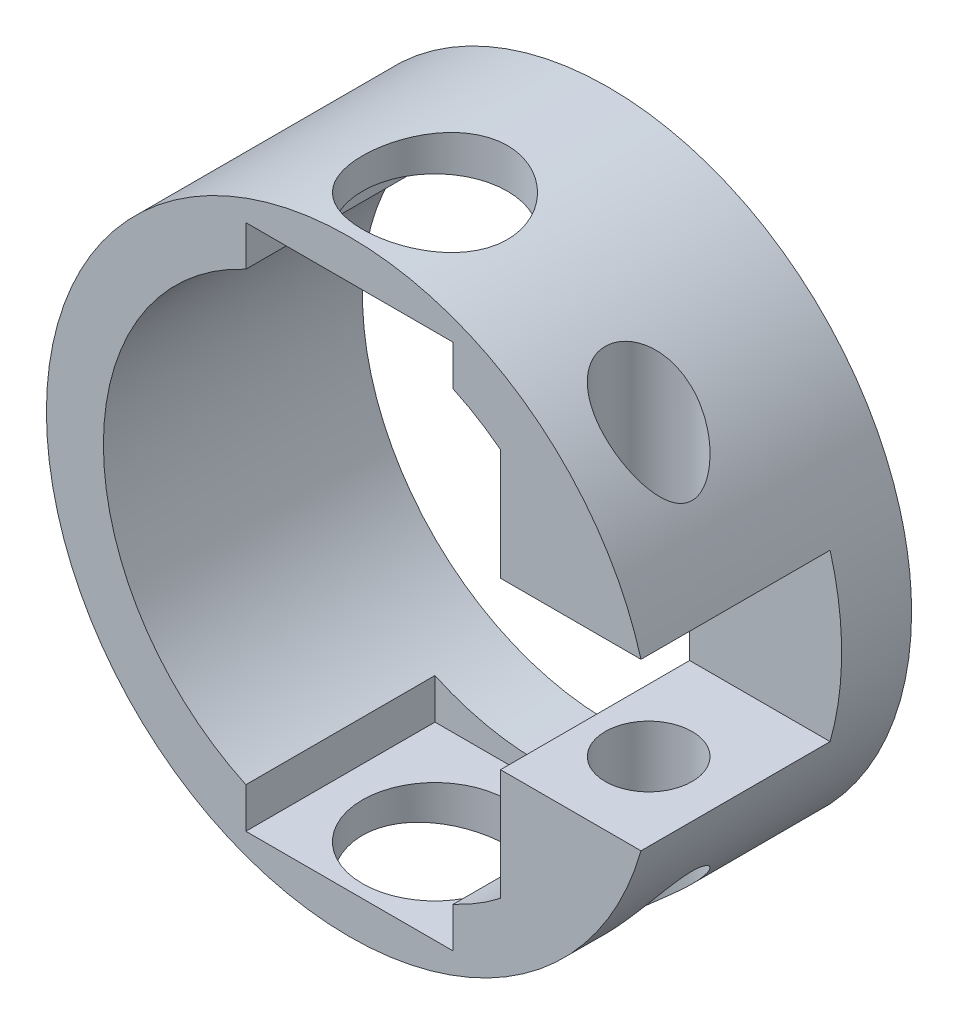
from build123d import *

# Parameters (mm, degrees)
SKETCH_1_R               = 11.7
EXTRUDE_1_DEPTH          = 10
CUT_EXTRUDE_1_DEPTH      = 20
CUT_EXTRUDE_1_DEPTH_BACK = 20
SKETCH_2_R               = 2.8
CUT_EXTRUDE_2_DEPTH      = 20
CUT_EXTRUDE_2_DEPTH_BACK = 20
SKETCH_3_R               = 1.675
CUT_EXTRUDE_3_DEPTH      = 10.175
CUT_EXTRUDE_3_DEPTH_BACK = 10.175
SKETCH_4_W               = 8
SKETCH_4_H               = 8
CUT_EXTRUDE_4_DEPTH      = 3.2
CUT_EXTRUDE_4_DEPTH_BACK = 3.2
SKETCH_5_W               = 10.742545564
SKETCH_5_H               = 8


with BuildPart() as part:
    # 草图1 → 凸台-拉伸1 (new body)
    with BuildSketch(Plane.XY):
        Circle(SKETCH_1_R)
        with BuildLine():
            Line((5.830951895, 7.5), (5.830951895, -7.5))
            ThreePointArc((5.830951895, -7.5), (-9.5, 0), (5.830951895, 7.5))
        make_face(mode=Mode.SUBTRACT)
    extrude(amount=EXTRUDE_1_DEPTH)

    # 草图2 → 切除-拉伸1 (cut, two sides: drawn at the far end of the back side and taken through both)
    with BuildSketch(Plane(origin=(0, 0, 0), x_dir=(1, 0, 0), z_dir=(0, 1, 0)).offset(-CUT_EXTRUDE_1_DEPTH_BACK)):
        with Locations((0, -6.7)):
            Circle(SKETCH_2_R)
    extrude(amount=CUT_EXTRUDE_1_DEPTH + CUT_EXTRUDE_1_DEPTH_BACK, mode=Mode.SUBTRACT)

    # 草图3 → 切除-拉伸2 (cut, two sides: drawn at the far end of the back side and taken through both)
    with BuildSketch(Plane(origin=(0, 0, 0), x_dir=(1, 0, 0), z_dir=(0, 1, 0)).offset(-CUT_EXTRUDE_2_DEPTH_BACK)):
        with Locations((8.25, -6.7)):
            Circle(SKETCH_3_R)
    extrude(amount=CUT_EXTRUDE_2_DEPTH + CUT_EXTRUDE_2_DEPTH_BACK, mode=Mode.SUBTRACT)

    # 草图4 → 切除-拉伸3 (cut, two sides: drawn at the far end of the back side and taken through both)
    with BuildSketch(Plane(origin=(0, 0, 0), x_dir=(1, 0, 0), z_dir=(0, 1, 0)).offset(-CUT_EXTRUDE_3_DEPTH_BACK)):
        with Locations((0, -6.7)):
            Rectangle(SKETCH_4_W, SKETCH_4_H)
    extrude(amount=CUT_EXTRUDE_3_DEPTH + CUT_EXTRUDE_3_DEPTH_BACK, mode=Mode.SUBTRACT)

    # 草图5 → 切除-拉伸4 (cut, two sides: drawn at the far end of the back side and taken through both)
    with BuildSketch(Plane(origin=(0, 0, 0), x_dir=(1, 0, 0), z_dir=(0, 1, 0)).offset(-CUT_EXTRUDE_4_DEPTH_BACK)):
        with Locations((8.25, -6.7)):
            Rectangle(SKETCH_5_W, SKETCH_5_H)
    extrude(amount=CUT_EXTRUDE_4_DEPTH + CUT_EXTRUDE_4_DEPTH_BACK, mode=Mode.SUBTRACT)


solid = part.part
